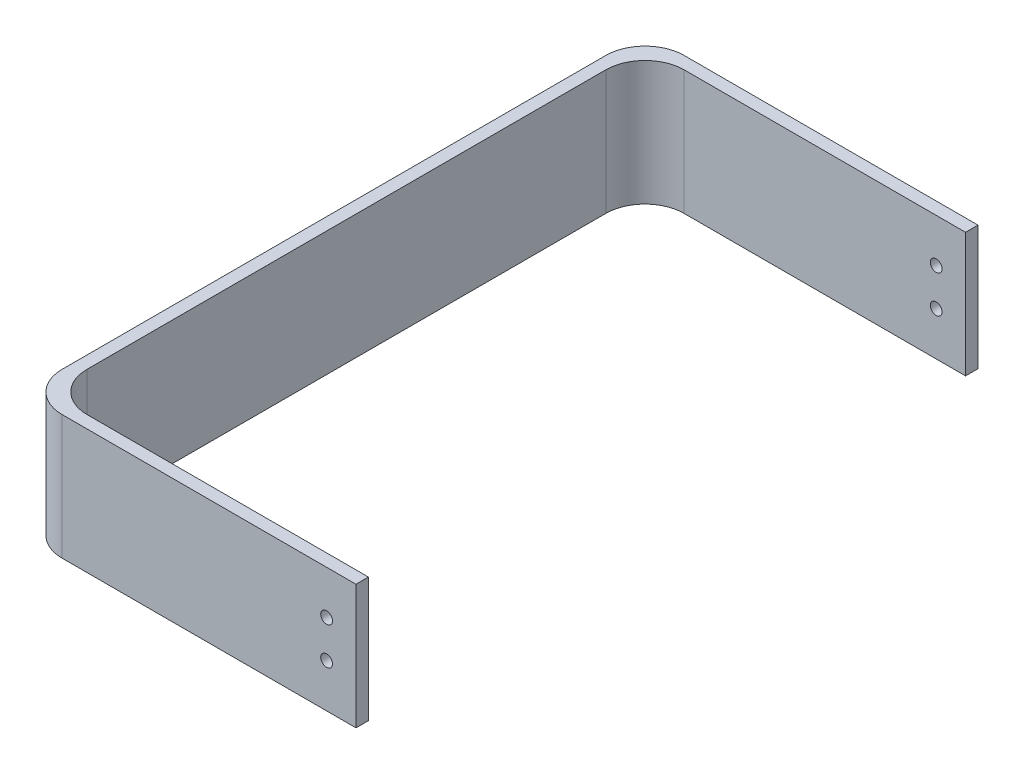
from build123d import *

# Parameters (mm, degrees)
BOSS_EXTRUDE1_DEPTH = 31.75
SKETCH2_R           = 1.5
CUT_EXTRUDE1_DEPTH  = 183.851374072
FILLET1_R           = 10


with BuildPart() as part:
    # Sketch1 → Boss-Extrude1 (new body)
    with BuildSketch(Plane(origin=(0, 0, 0), x_dir=(1, 0, 0), z_dir=(0, 1, 0))):
        Polygon((0, 0), (-85, 0), (-85, 158.75), (0, 158.75), (0, 155.575), (-81.825, 155.575), (-81.825, 3.175), (0, 3.175), align=None)
    extrude(amount=BOSS_EXTRUDE1_DEPTH)

    # Sketch2 → Cut-Extrude1 (cut, through all)
    with BuildSketch(Plane.XY):
        with Locations((-7.5, 11.1125)):
            Circle(SKETCH2_R)
        with Locations((-7.5, 20.6375)):
            Circle(SKETCH2_R)
    extrude(amount=-CUT_EXTRUDE1_DEPTH, mode=Mode.SUBTRACT)

    # Fillet1
    fillet1_edges = [part.edges().sort_by_distance(p)[0] for p in [
        (-85, 15.875, 0),
        (-85, 15.875, -158.75),
        (-81.825, 15.875, -155.575),
        (-81.825, 15.875, -3.175),
    ]]
    fillet(fillet1_edges, radius=FILLET1_R)


solid = part.part
